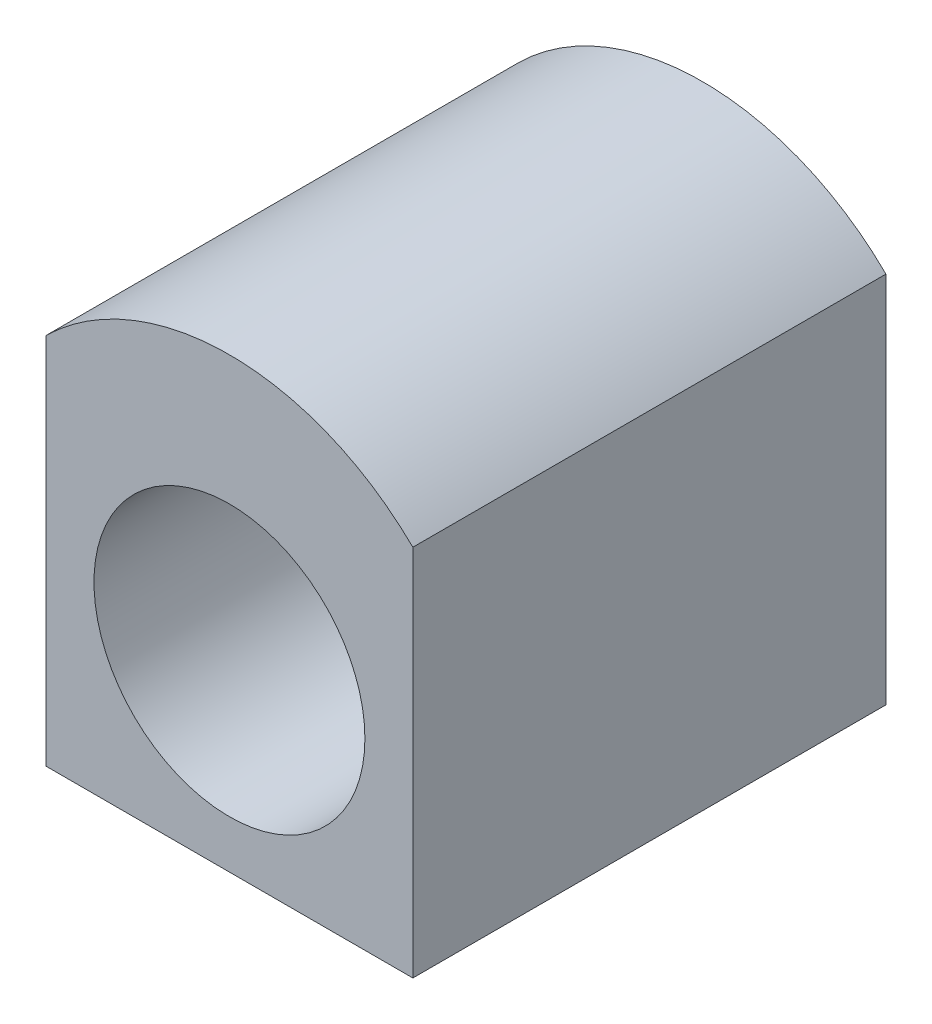
from build123d import *

# Parameters (mm, degrees)
EXTRUDE_1_DEPTH     = 22.7
SKETCH_2_R          = 6.5
CUT_EXTRUDE_1_DEPTH = 33.480455662


with BuildPart() as part:
    # Эскиз1 → Бобышка-Вытянуть1 (new body)
    with BuildSketch(Plane.XY):
        with BuildLine():
            Line((-8.8, 0), (8.8, 0))
            Line((8.8, 0), (8.8, 17.9))
            ThreePointArc((8.8, 17.9), (0, 21.5), (-8.8, 17.9))
            Line((-8.8, 17.9), (-8.8, 0))
        make_face()
    extrude(amount=EXTRUDE_1_DEPTH)

    # Эскиз2 → Вырез-Вытянуть1 (cut, through all)
    with BuildSketch(Plane.XY.offset(22.7)):
        with Locations((0, 8.8)):
            Circle(SKETCH_2_R)
    extrude(amount=-CUT_EXTRUDE_1_DEPTH, mode=Mode.SUBTRACT)


solid = part.part
